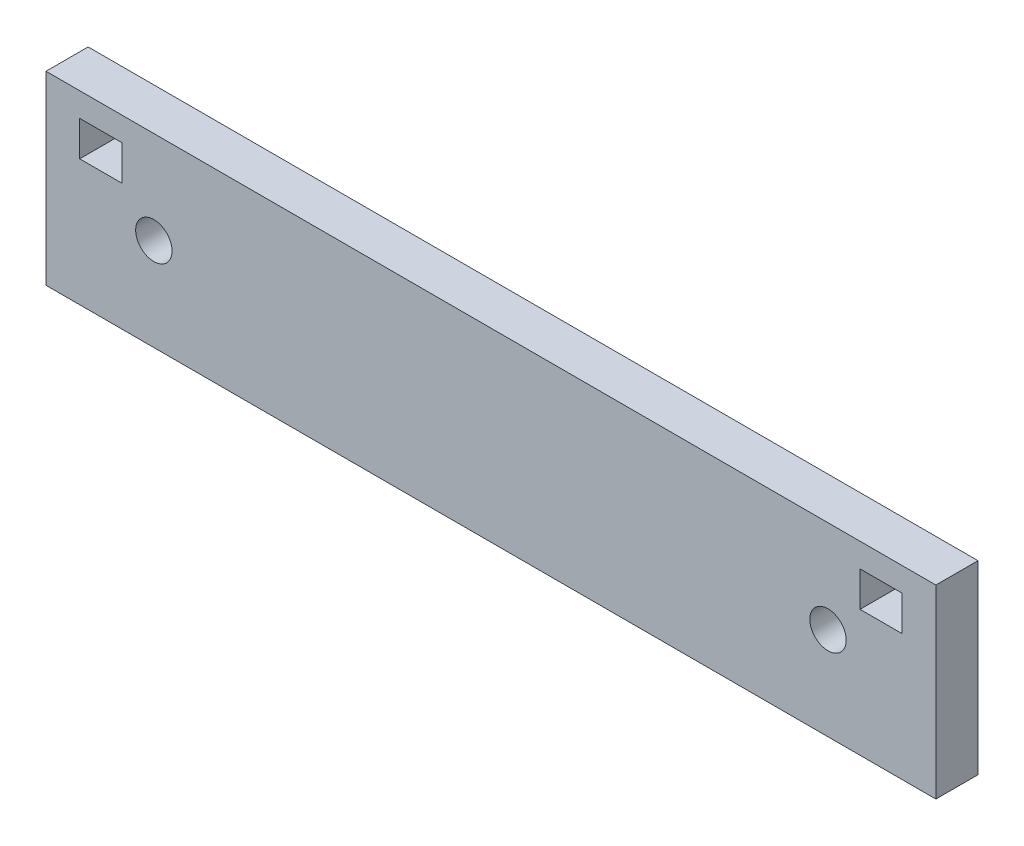
from build123d import *

# Parameters (mm, degrees)
SKETCH1_W           = 33.528
SKETCH1_H           = 6.985
SKETCH1_R           = 0.6858
SKETCH1_W_2         = 1.5875
SKETCH1_H_2         = 1.3208
BOSS_EXTRUDE1_DEPTH = 1.5875


with BuildPart() as part:
    # Sketch1 → Boss-Extrude1 (new body)
    with BuildSketch(Plane.XY):
        Rectangle(SKETCH1_W, SKETCH1_H)
        with Locations((-12.7, 0)):
            Circle(SKETCH1_R, mode=Mode.SUBTRACT)
        with Locations(Location((12.7, 0, 0), (0, 0, 180))):
            Circle(SKETCH1_R, mode=Mode.SUBTRACT)
        with Locations((14.70025, 1.9304)):
            Rectangle(SKETCH1_W_2, SKETCH1_H_2, mode=Mode.SUBTRACT)
        with Locations((-14.70025, 1.9304)):
            Rectangle(SKETCH1_W_2, SKETCH1_H_2, mode=Mode.SUBTRACT)
    extrude(amount=BOSS_EXTRUDE1_DEPTH)


solid = part.part
